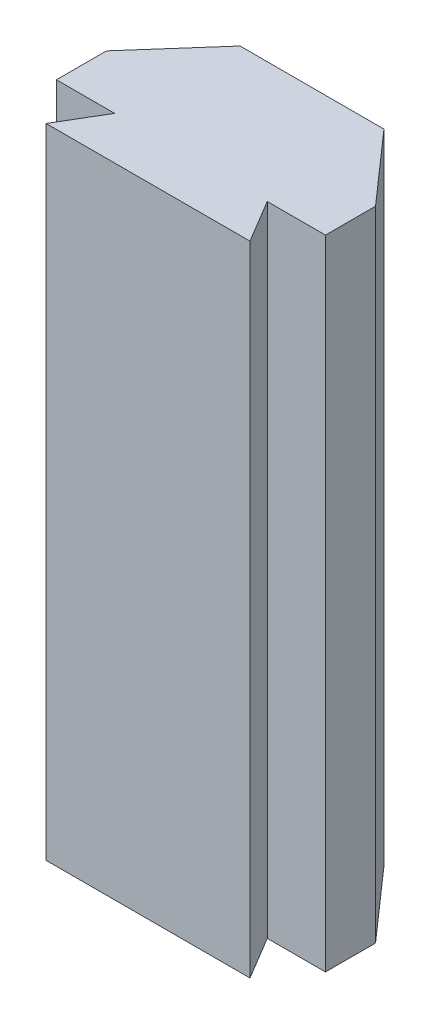
from build123d import *

# Parameters (mm, degrees)
BOSS_EXTRUDE4_DEPTH = 25.5


with BuildPart() as part:
    # Sketch7 → Boss-Extrude4 (new body)
    with BuildSketch(Plane(origin=(0, 0, 0), x_dir=(1, 0, 0), z_dir=(0, 1, 0))):
        Polygon((-5.190577257, 5.674399213), (0.559422743, 5.674399213), (3.059422743, 2.837587622), (3.059422743, 0.837587622), (0.734422743, 0.837587622), (1.759422743, -0.879786827), (-6.385777605, -0.882642377), (-5.365577257, 0.837587622), (-7.690577257, 0.837587622), (-7.690577257, 2.837587622), align=None)
    extrude(amount=BOSS_EXTRUDE4_DEPTH)


solid = part.part
